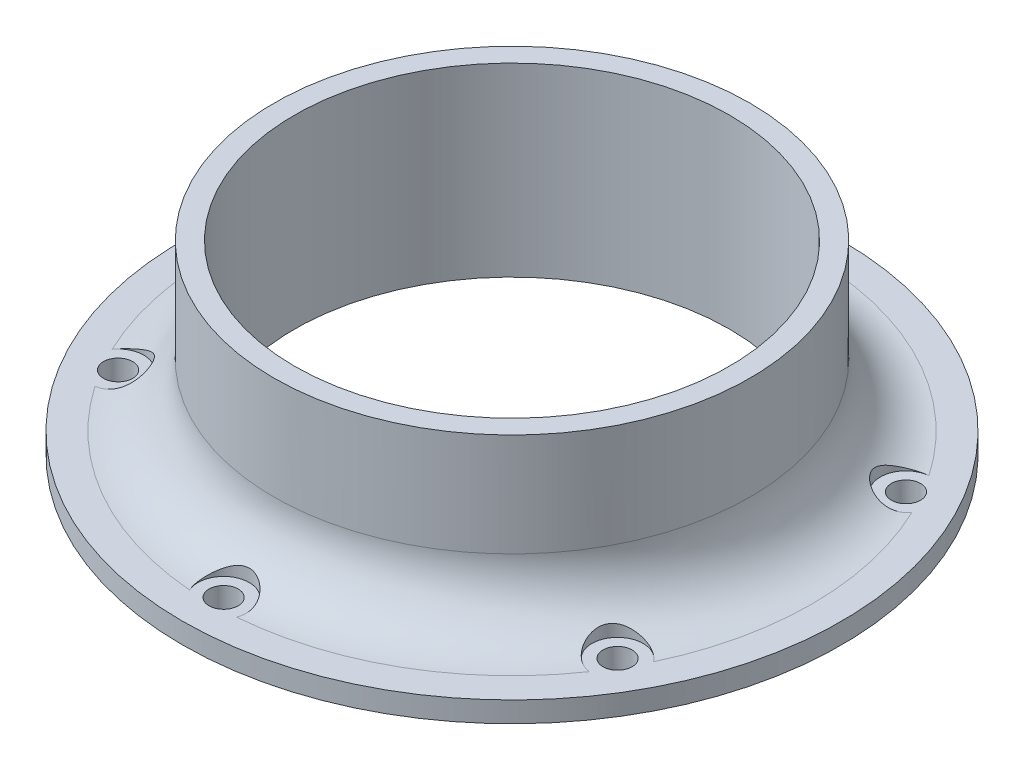
from build123d import *
from build123d.topology import SkipClean

# Parameters (mm, degrees)
SKETCH1_R           = 36.703
SKETCH1_R_2         = 33.528
BOSS_EXTRUDE1_DEPTH = 25.4
BOSS_EXTRUDE2_START = 3.175
SKETCH2_R           = 50.8
SKETCH2_R_2         = 33.528
BOSS_EXTRUDE2_DEPTH = 3.175
FILLET1_R           = 9.525
SKETCH5_W           = 2.2479
SKETCH5_H           = 3.175
CIRPATTERN1_COUNT   = 6
SKETCH6_R           = 3.9624
CUT_EXTRUDE1_DEPTH  = 52.07
CIRPATTERN2_COUNT   = 6


with BuildPart() as part:
    # Sketch1 → Boss-Extrude1 (new body)
    with BuildSketch(Plane(origin=(0, 0, 0), x_dir=(1, 0, 0), z_dir=(0, 1, 0))):
        with Locations(Location((0, 0, 0), (0, 0, 270))):
            Circle(SKETCH1_R)
        with Locations(Location((0, 0, 0), (0, 0, 270))):
            Circle(SKETCH1_R_2, mode=Mode.SUBTRACT)
    extrude(amount=BOSS_EXTRUDE1_DEPTH)

    # Sketch2 → Boss-Extrude2 (add)
    with SkipClean():  # the faces are left unmerged after this step: merging them gives an invalid solid
        with BuildSketch(Plane.XZ.offset(BOSS_EXTRUDE2_START)):
            with Locations(Location((0, 0, 0), (0, 0, 270))):
                Circle(SKETCH2_R)
            with Locations(Location((0, 0, 0), (0, 0, 270))):
                Circle(SKETCH2_R_2, mode=Mode.SUBTRACT)
        extrude(amount=-BOSS_EXTRUDE2_DEPTH)

    # Fillet1
    fillet1_edges = [part.edges().sort_by_distance(p)[0] for p in [
        (0, 0, -36.703),
    ]]
    fillet(fillet1_edges, radius=FILLET1_R)

    # Sketch5 → #8 Clearance Hole1 (revolve, cut)
    with SkipClean():  # the faces are left unmerged after this step: merging them gives an invalid solid
        with BuildSketch(Plane(origin=(0, 0, -44.45), x_dir=(0, 0, 1), z_dir=(1, 0, 0))):
            with Locations((1.12395, 1.5875)):
                Rectangle(SKETCH5_W, SKETCH5_H)
        f_8_clearance_hole1 = revolve(axis=Axis((0, 6.35, -44.45), (0, -1, 0)), mode=Mode.SUBTRACT)

    # CirPattern1: #8 Clearance Hole1 ×6 about axis
    with SkipClean():  # the faces are left unmerged after this step: merging them gives an invalid solid
        cirpattern1_axis = Axis((0, 0, 0), (0, 1, 0))
        for i in range(1, CIRPATTERN1_COUNT):
            add(f_8_clearance_hole1.rotate(cirpattern1_axis, i * 360 / CIRPATTERN1_COUNT), mode=Mode.SUBTRACT)

    # Sketch6 → Cut-Extrude1 (cut)
    with SkipClean():  # the faces are left unmerged after this step: merging them gives an invalid solid
        with BuildSketch(Plane(origin=(0, 0, 0), x_dir=(1, 0, 0), z_dir=(0, 1, 0))):
            with Locations((0, 44.45)):
                Circle(SKETCH6_R)
        cut_extrude1 = extrude(amount=CUT_EXTRUDE1_DEPTH, mode=Mode.SUBTRACT)

    # CirPattern2: Cut-Extrude1 ×6 about axis
    with SkipClean():  # the faces are left unmerged after this step: merging them gives an invalid solid
        cirpattern2_axis = Axis((0, 0, 0), (0, 1, 0))
        for i in range(1, CIRPATTERN2_COUNT):
            add(cut_extrude1.rotate(cirpattern2_axis, i * 360 / CIRPATTERN2_COUNT), mode=Mode.SUBTRACT)


solid = part.part
